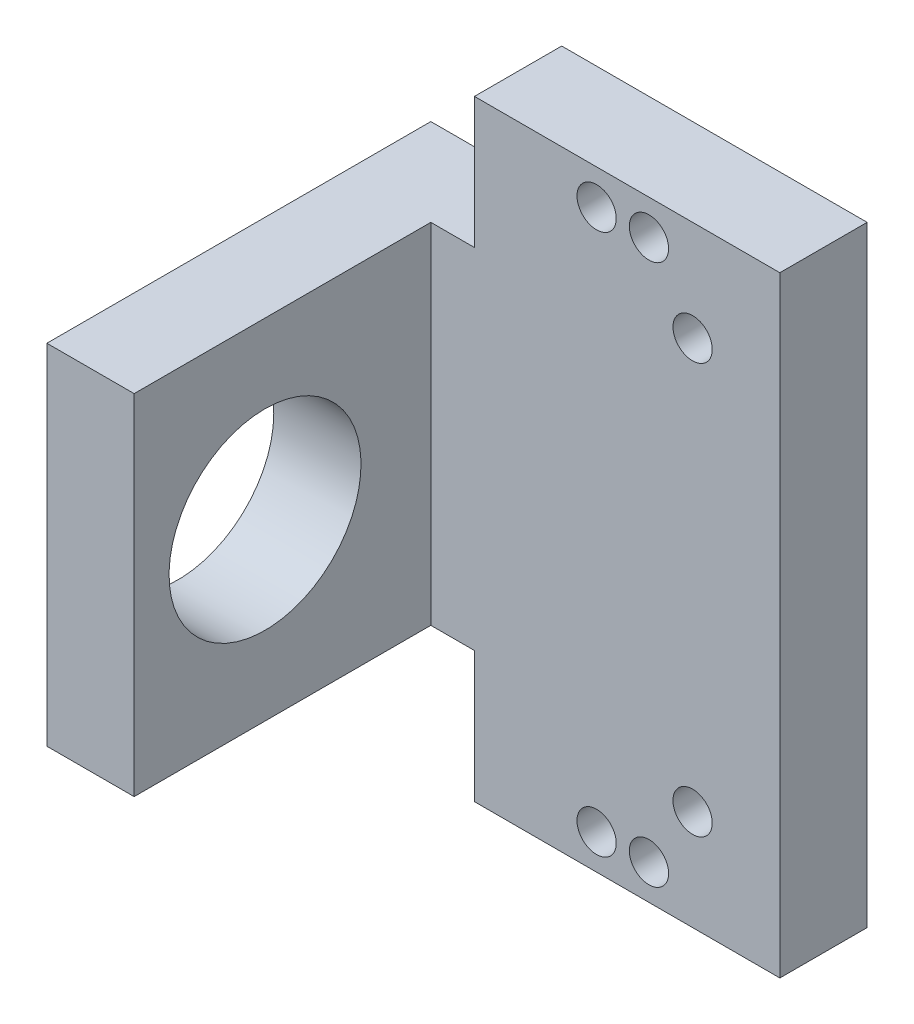
from build123d import *

# Parameters (mm, degrees)
SKETCH_1_W          = 50
SKETCH_1_H          = 70
EXTRUDE_1_DEPTH     = 10
SKETCH_2_W          = 10
SKETCH_2_H          = 70
EXTRUDE_2_DEPTH     = 34
SKETCH_3_R          = 11
CUT_EXTRUDE_1_DEPTH = 32
SKETCH_4_R          = 2.25
CUT_EXTRUDE_2_DEPTH = 93.498648639
SKETCH_5_R          = 2.25
CUT_EXTRUDE_3_DEPTH = 93.498648639
SKETCH_6_W          = 34
SKETCH_6_H          = 15
CUT_EXTRUDE_4_DEPTH = 92.847700026
SKETCH_7_W          = 15
SKETCH_7_H          = 15
CUT_EXTRUDE_5_DEPTH = 93.498648639


with BuildPart() as part:
    # 草图1 → 凸台-拉伸1 (new body)
    with BuildSketch(Plane.XY):
        with Locations((25, 35)):
            Rectangle(SKETCH_1_W, SKETCH_1_H)
    extrude(amount=EXTRUDE_1_DEPTH)

    # 草图2 → 凸台-拉伸2 (add)
    with BuildSketch(Plane.XY.offset(10)):
        with Locations((5, 35)):
            Rectangle(SKETCH_2_W, SKETCH_2_H)
    extrude(amount=EXTRUDE_2_DEPTH)

    # 草图3 → 切除-拉伸1 (cut)
    with BuildSketch(Plane(origin=(10, 0, 0), x_dir=(0, 0, -1), z_dir=(1, 0, 0))):
        with Locations(Location((-29, 35, 0), (0, 0, 90))):
            Circle(SKETCH_3_R)
    extrude(amount=-CUT_EXTRUDE_1_DEPTH, mode=Mode.SUBTRACT)

    # 草图4 → 切除-拉伸2 (cut, through all)
    with BuildSketch(Plane.XY.offset(10)):
        with Locations((40, 11.5)):
            Circle(SKETCH_4_R)
        with Locations(Location((40, 58.5, 0), (0, 0, 180))):
            Circle(SKETCH_4_R)
    extrude(amount=-CUT_EXTRUDE_2_DEPTH, mode=Mode.SUBTRACT)

    # 草图5 → 切除-拉伸3 (cut, through all)
    with BuildSketch(Plane.XY.offset(10)):
        with Locations((35, 66)):
            Circle(SKETCH_5_R)
        with Locations(Location((35, 4, 0), (0, 0, 180))):
            Circle(SKETCH_5_R)
        with Locations((29, 4)):
            Circle(SKETCH_5_R)
        with Locations(Location((29, 66, 0), (0, 0, 180))):
            Circle(SKETCH_5_R)
    extrude(amount=-CUT_EXTRUDE_3_DEPTH, mode=Mode.SUBTRACT)

    # 草图6 → 切除-拉伸4 (cut, through all)
    with BuildSketch(Plane(origin=(10, 0, 0), x_dir=(0, 0, -1), z_dir=(1, 0, 0))):
        with Locations((-27, 7.5)):
            Rectangle(SKETCH_6_W, SKETCH_6_H)
        with Locations((-27, 62.5)):
            Rectangle(SKETCH_6_W, SKETCH_6_H)
    extrude(amount=-CUT_EXTRUDE_4_DEPTH, mode=Mode.SUBTRACT)

    # 草图7 → 切除-拉伸5 (cut, through all)
    with BuildSketch(Plane.XY.offset(10)):
        with Locations((7.5, 7.5)):
            Rectangle(SKETCH_7_W, SKETCH_7_H)
        with Locations((7.5, 62.5)):
            Rectangle(SKETCH_7_W, SKETCH_7_H)
    extrude(amount=-CUT_EXTRUDE_5_DEPTH, mode=Mode.SUBTRACT)


solid = part.part
